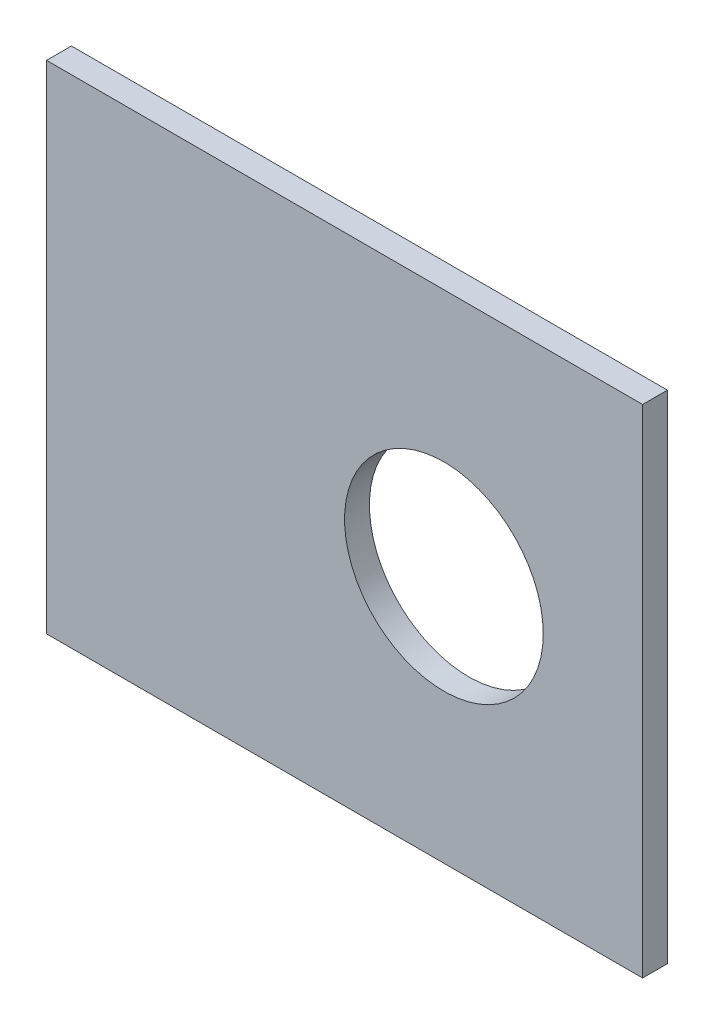
from build123d import *

# Parameters (mm, degrees)
SKETCH1_W           = 76.2
SKETCH1_H           = 63.5
SKETCH1_R           = 12.7
BOSS_EXTRUDE1_DEPTH = 3.175


with BuildPart() as part:
    # Sketch1 → Boss-Extrude1 (new body)
    with BuildSketch(Plane.XY):
        with Locations((38.1, 31.75)):
            Rectangle(SKETCH1_W, SKETCH1_H)
        with Locations((50.8, 31.75)):
            Circle(SKETCH1_R, mode=Mode.SUBTRACT)
    extrude(amount=BOSS_EXTRUDE1_DEPTH)


solid = part.part
